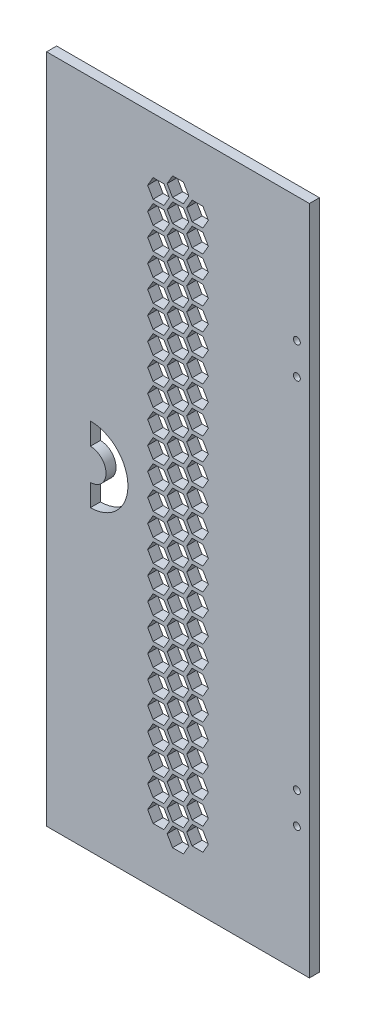
from build123d import *

# Parameters (mm, degrees)
SKETCH1_W           = 210
SKETCH1_H           = 536
SKETCH1_R           = 2.75
SKETCH1_R_2         = 2.749999922
SKETCH1_R_3         = 2.749999896
BOSS_EXTRUDE1_DEPTH = 8
CUT_EXTRUDE4_DEPTH  = 10
CUT_EXTRUDE5_DEPTH  = 10


with BuildPart() as part:
    # Sketch1 → Boss-Extrude1 (new body)
    with BuildSketch(Plane.XY):
        Rectangle(SKETCH1_W, SKETCH1_H)
        with Locations((95, -168)):
            Circle(SKETCH1_R, mode=Mode.SUBTRACT)
        with Locations((95, 168)):
            Circle(SKETCH1_R, mode=Mode.SUBTRACT)
        with Locations((95, 143)):
            Circle(SKETCH1_R_2, mode=Mode.SUBTRACT)
        with Locations((95, -143.000001745)):
            Circle(SKETCH1_R_3, mode=Mode.SUBTRACT)
    extrude(amount=BOSS_EXTRUDE1_DEPTH)

    # Sketch3 → Cut-Extrude4 (cut)
    with BuildSketch(Plane.XY.offset(8)):
        Polygon((24.248711306, 216), (19.918584287, 223.5), (11.258330249, 223.5), (6.92820323, 216), (11.258330249, 208.5), (19.918584287, 208.5), align=None)
        Polygon((-6.92820323, 216), (-11.258330249, 223.5), (-19.918584287, 223.5), (-24.248711306, 216), (-19.918584287, 208.5), (-11.258330249, 208.5), align=None)
        Polygon((8.660254038, 207), (4.330127019, 214.5), (-4.330127019, 214.5), (-8.660254038, 207), (-4.330127019, 199.5), (4.330127019, 199.5), align=None)
        Polygon((24.248711306, 72), (19.918584287, 79.5), (11.258330249, 79.5), (6.92820323, 72), (11.258330249, 64.5), (19.918584287, 64.5), align=None)
        Polygon((-6.92820323, 72), (-11.258330249, 79.5), (-19.918584287, 79.5), (-24.248711306, 72), (-19.918584287, 64.5), (-11.258330249, 64.5), align=None)
        Polygon((8.660254038, 225), (4.330127019, 232.5), (-4.330127019, 232.5), (-8.660254038, 225), (-4.330127019, 217.5), (4.330127019, 217.5), align=None)
        Polygon((24.248711306, 198), (19.918584287, 205.5), (11.258330249, 205.5), (6.92820323, 198), (11.258330249, 190.5), (19.918584287, 190.5), align=None)
        Polygon((-6.92820323, 198), (-11.258330249, 205.5), (-19.918584287, 205.5), (-24.248711306, 198), (-19.918584287, 190.5), (-11.258330249, 190.5), align=None)
        Polygon((8.660254038, 189), (4.330127019, 196.5), (-4.330127019, 196.5), (-8.660254038, 189), (-4.330127019, 181.5), (4.330127019, 181.5), align=None)
        Polygon((24.248711306, 180), (19.918584287, 187.5), (11.258330249, 187.5), (6.92820323, 180), (11.258330249, 172.5), (19.918584287, 172.5), align=None)
        Polygon((-6.92820323, 180), (-11.258330249, 187.5), (-19.918584287, 187.5), (-24.248711306, 180), (-19.918584287, 172.5), (-11.258330249, 172.5), align=None)
        Polygon((8.660254038, 171), (4.330127019, 178.5), (-4.330127019, 178.5), (-8.660254038, 171), (-4.330127019, 163.5), (4.330127019, 163.5), align=None)
        Polygon((24.248711306, 162), (19.918584287, 169.5), (11.258330249, 169.5), (6.92820323, 162), (11.258330249, 154.5), (19.918584287, 154.5), align=None)
        Polygon((-6.92820323, 162), (-11.258330249, 169.5), (-19.918584287, 169.5), (-24.248711306, 162), (-19.918584287, 154.5), (-11.258330249, 154.5), align=None)
        Polygon((8.660254038, 153), (4.330127019, 160.5), (-4.330127019, 160.5), (-8.660254038, 153), (-4.330127019, 145.5), (4.330127019, 145.5), align=None)
        Polygon((24.248711306, 144), (19.918584287, 151.5), (11.258330249, 151.5), (6.92820323, 144), (11.258330249, 136.5), (19.918584287, 136.5), align=None)
        Polygon((-6.92820323, 144), (-11.258330249, 151.5), (-19.918584287, 151.5), (-24.248711306, 144), (-19.918584287, 136.5), (-11.258330249, 136.5), align=None)
        Polygon((8.660254038, 135), (4.330127019, 142.5), (-4.330127019, 142.5), (-8.660254038, 135), (-4.330127019, 127.5), (4.330127019, 127.5), align=None)
        Polygon((24.248711306, 126), (19.918584287, 133.5), (11.258330249, 133.5), (6.92820323, 126), (11.258330249, 118.5), (19.918584287, 118.5), align=None)
        Polygon((-6.92820323, 126), (-11.258330249, 133.5), (-19.918584287, 133.5), (-24.248711306, 126), (-19.918584287, 118.5), (-11.258330249, 118.5), align=None)
        Polygon((8.660254038, 117), (4.330127019, 124.5), (-4.330127019, 124.5), (-8.660254038, 117), (-4.330127019, 109.5), (4.330127019, 109.5), align=None)
        Polygon((24.248711306, 108), (19.918584287, 115.5), (11.258330249, 115.5), (6.92820323, 108), (11.258330249, 100.5), (19.918584287, 100.5), align=None)
        Polygon((-6.92820323, 108), (-11.258330249, 115.5), (-19.918584287, 115.5), (-24.248711306, 108), (-19.918584287, 100.5), (-11.258330249, 100.5), align=None)
        Polygon((8.660254038, 99), (4.330127019, 106.5), (-4.330127019, 106.5), (-8.660254038, 99), (-4.330127019, 91.5), (4.330127019, 91.5), align=None)
        Polygon((24.248711306, 90), (19.918584287, 97.5), (11.258330249, 97.5), (6.92820323, 90), (11.258330249, 82.5), (19.918584287, 82.5), align=None)
        Polygon((-6.92820323, 90), (-11.258330249, 97.5), (-19.918584287, 97.5), (-24.248711306, 90), (-19.918584287, 82.5), (-11.258330249, 82.5), align=None)
        Polygon((8.660254038, 81), (4.330127019, 88.5), (-4.330127019, 88.5), (-8.660254038, 81), (-4.330127019, 73.5), (4.330127019, 73.5), align=None)
        Polygon((8.660254038, 63), (4.330127019, 70.5), (-4.330127019, 70.5), (-8.660254038, 63), (-4.330127019, 55.5), (4.330127019, 55.5), align=None)
        Polygon((24.248711306, 54), (19.918584287, 61.5), (11.258330249, 61.5), (6.92820323, 54), (11.258330249, 46.5), (19.918584287, 46.5), align=None)
        Polygon((-6.92820323, 54), (-11.258330249, 61.5), (-19.918584287, 61.5), (-24.248711306, 54), (-19.918584287, 46.5), (-11.258330249, 46.5), align=None)
        Polygon((8.660254038, 45), (4.330127019, 52.5), (-4.330127019, 52.5), (-8.660254038, 45), (-4.330127019, 37.5), (4.330127019, 37.5), align=None)
        Polygon((24.248711306, 36), (19.918584287, 43.5), (11.258330249, 43.5), (6.92820323, 36), (11.258330249, 28.5), (19.918584287, 28.5), align=None)
        Polygon((-6.92820323, 36), (-11.258330249, 43.5), (-19.918584287, 43.5), (-24.248711306, 36), (-19.918584287, 28.5), (-11.258330249, 28.5), align=None)
        Polygon((8.660254038, 27), (4.330127019, 34.5), (-4.330127019, 34.5), (-8.660254038, 27), (-4.330127019, 19.5), (4.330127019, 19.5), align=None)
        Polygon((24.248711306, 18), (19.918584287, 25.5), (11.258330249, 25.5), (6.92820323, 18), (11.258330249, 10.5), (19.918584287, 10.5), align=None)
        Polygon((-6.92820323, 18), (-11.258330249, 25.5), (-19.918584287, 25.5), (-24.248711306, 18), (-19.918584287, 10.5), (-11.258330249, 10.5), align=None)
        Polygon((8.660254038, 9), (4.330127019, 16.5), (-4.330127019, 16.5), (-8.660254038, 9), (-4.330127019, 1.5), (4.330127019, 1.5), align=None)
        Polygon((24.248711306, 0), (19.918584287, 7.5), (11.258330249, 7.5), (6.92820323, 0), (11.258330249, -7.5), (19.918584287, -7.5), align=None)
        Polygon((-6.92820323, 0), (-11.258330249, 7.5), (-19.918584287, 7.5), (-24.248711306, 0), (-19.918584287, -7.5), (-11.258330249, -7.5), align=None)
        Polygon((8.660254038, -9), (4.330127019, -1.5), (-4.330127019, -1.5), (-8.660254038, -9), (-4.330127019, -16.5), (4.330127019, -16.5), align=None)
        Polygon((24.248711306, -18), (19.918584287, -10.5), (11.258330249, -10.5), (6.92820323, -18), (11.258330249, -25.5), (19.918584287, -25.5), align=None)
        Polygon((-6.92820323, -18), (-11.258330249, -10.5), (-19.918584287, -10.5), (-24.248711306, -18), (-19.918584287, -25.5), (-11.258330249, -25.5), align=None)
        Polygon((8.660254038, -27), (4.330127019, -19.5), (-4.330127019, -19.5), (-8.660254038, -27), (-4.330127019, -34.5), (4.330127019, -34.5), align=None)
        Polygon((24.248711306, -36), (19.918584287, -28.5), (11.258330249, -28.5), (6.92820323, -36), (11.258330249, -43.5), (19.918584287, -43.5), align=None)
        Polygon((-6.92820323, -36), (-11.258330249, -28.5), (-19.918584287, -28.5), (-24.248711306, -36), (-19.918584287, -43.5), (-11.258330249, -43.5), align=None)
        Polygon((8.660254038, -45), (4.330127019, -37.5), (-4.330127019, -37.5), (-8.660254038, -45), (-4.330127019, -52.5), (4.330127019, -52.5), align=None)
        Polygon((24.248711306, -54), (19.918584287, -46.5), (11.258330249, -46.5), (6.92820323, -54), (11.258330249, -61.5), (19.918584287, -61.5), align=None)
        Polygon((-6.92820323, -54), (-11.258330249, -46.5), (-19.918584287, -46.5), (-24.248711306, -54), (-19.918584287, -61.5), (-11.258330249, -61.5), align=None)
        Polygon((8.660254038, -63), (4.330127019, -55.5), (-4.330127019, -55.5), (-8.660254038, -63), (-4.330127019, -70.5), (4.330127019, -70.5), align=None)
        Polygon((24.248711306, -72), (19.918584287, -64.5), (11.258330249, -64.5), (6.92820323, -72), (11.258330249, -79.5), (19.918584287, -79.5), align=None)
        Polygon((-6.92820323, -72), (-11.258330249, -64.5), (-19.918584287, -64.5), (-24.248711306, -72), (-19.918584287, -79.5), (-11.258330249, -79.5), align=None)
        Polygon((8.660254038, -81), (4.330127019, -73.5), (-4.330127019, -73.5), (-8.660254038, -81), (-4.330127019, -88.5), (4.330127019, -88.5), align=None)
        Polygon((24.248711306, -90), (19.918584287, -82.5), (11.258330249, -82.5), (6.92820323, -90), (11.258330249, -97.5), (19.918584287, -97.5), align=None)
        Polygon((-6.92820323, -90), (-11.258330249, -82.5), (-19.918584287, -82.5), (-24.248711306, -90), (-19.918584287, -97.5), (-11.258330249, -97.5), align=None)
        Polygon((8.660254038, -99), (4.330127019, -91.5), (-4.330127019, -91.5), (-8.660254038, -99), (-4.330127019, -106.5), (4.330127019, -106.5), align=None)
        Polygon((24.248711306, -108), (19.918584287, -100.5), (11.258330249, -100.5), (6.92820323, -108), (11.258330249, -115.5), (19.918584287, -115.5), align=None)
        Polygon((-6.92820323, -108), (-11.258330249, -100.5), (-19.918584287, -100.5), (-24.248711306, -108), (-19.918584287, -115.5), (-11.258330249, -115.5), align=None)
        Polygon((8.660254038, -117), (4.330127019, -109.5), (-4.330127019, -109.5), (-8.660254038, -117), (-4.330127019, -124.5), (4.330127019, -124.5), align=None)
        Polygon((24.248711306, -126), (19.918584287, -118.5), (11.258330249, -118.5), (6.92820323, -126), (11.258330249, -133.5), (19.918584287, -133.5), align=None)
        Polygon((-6.92820323, -126), (-11.258330249, -118.5), (-19.918584287, -118.5), (-24.248711306, -126), (-19.918584287, -133.5), (-11.258330249, -133.5), align=None)
        Polygon((8.660254038, -135), (4.330127019, -127.5), (-4.330127019, -127.5), (-8.660254038, -135), (-4.330127019, -142.5), (4.330127019, -142.5), align=None)
        Polygon((24.248711306, -144), (19.918584287, -136.5), (11.258330249, -136.5), (6.92820323, -144), (11.258330249, -151.5), (19.918584287, -151.5), align=None)
        Polygon((-6.92820323, -144), (-11.258330249, -136.5), (-19.918584287, -136.5), (-24.248711306, -144), (-19.918584287, -151.5), (-11.258330249, -151.5), align=None)
        Polygon((8.660254038, -153), (4.330127019, -145.5), (-4.330127019, -145.5), (-8.660254038, -153), (-4.330127019, -160.5), (4.330127019, -160.5), align=None)
        Polygon((24.248711306, -162), (19.918584287, -154.5), (11.258330249, -154.5), (6.92820323, -162), (11.258330249, -169.5), (19.918584287, -169.5), align=None)
        Polygon((-6.92820323, -162), (-11.258330249, -154.5), (-19.918584287, -154.5), (-24.248711306, -162), (-19.918584287, -169.5), (-11.258330249, -169.5), align=None)
        Polygon((8.660254038, -171), (4.330127019, -163.5), (-4.330127019, -163.5), (-8.660254038, -171), (-4.330127019, -178.5), (4.330127019, -178.5), align=None)
        Polygon((24.248711306, -180), (19.918584287, -172.5), (11.258330249, -172.5), (6.92820323, -180), (11.258330249, -187.5), (19.918584287, -187.5), align=None)
        Polygon((-6.92820323, -180), (-11.258330249, -172.5), (-19.918584287, -172.5), (-24.248711306, -180), (-19.918584287, -187.5), (-11.258330249, -187.5), align=None)
        Polygon((8.660254038, -189), (4.330127019, -181.5), (-4.330127019, -181.5), (-8.660254038, -189), (-4.330127019, -196.5), (4.330127019, -196.5), align=None)
        Polygon((24.248711306, -198), (19.918584287, -190.5), (11.258330249, -190.5), (6.92820323, -198), (11.258330249, -205.5), (19.918584287, -205.5), align=None)
        Polygon((-6.92820323, -198), (-11.258330249, -190.5), (-19.918584287, -190.5), (-24.248711306, -198), (-19.918584287, -205.5), (-11.258330249, -205.5), align=None)
        Polygon((8.660254038, -207), (4.330127019, -199.5), (-4.330127019, -199.5), (-8.660254038, -207), (-4.330127019, -214.5), (4.330127019, -214.5), align=None)
        Polygon((24.248711306, -216), (19.918584287, -208.5), (11.258330249, -208.5), (6.92820323, -216), (11.258330249, -223.5), (19.918584287, -223.5), align=None)
        Polygon((-6.92820323, -216), (-11.258330249, -208.5), (-19.918584287, -208.5), (-24.248711306, -216), (-19.918584287, -223.5), (-11.258330249, -223.5), align=None)
        Polygon((8.660254038, -225), (4.330127019, -217.5), (-4.330127019, -217.5), (-8.660254038, -225), (-4.330127019, -232.5), (4.330127019, -232.5), align=None)
    extrude(amount=-CUT_EXTRUDE4_DEPTH, mode=Mode.SUBTRACT)

    # Sketch4 → Cut-Extrude5 (cut)
    with BuildSketch(Plane(origin=(0, 0, 0), x_dir=(-1, 0, 0), z_dir=(0, 0, -1))):
        with BuildLine():
            Line((70, 30), (70, 12.5))
            ThreePointArc((70, 12.5), (57.5, 0), (70, -12.5))
            Line((70, -12.5), (70, -30))
            ThreePointArc((70, -30), (40, 0), (70, 30))
        make_face()
    extrude(amount=-CUT_EXTRUDE5_DEPTH, mode=Mode.SUBTRACT)


solid = part.part
